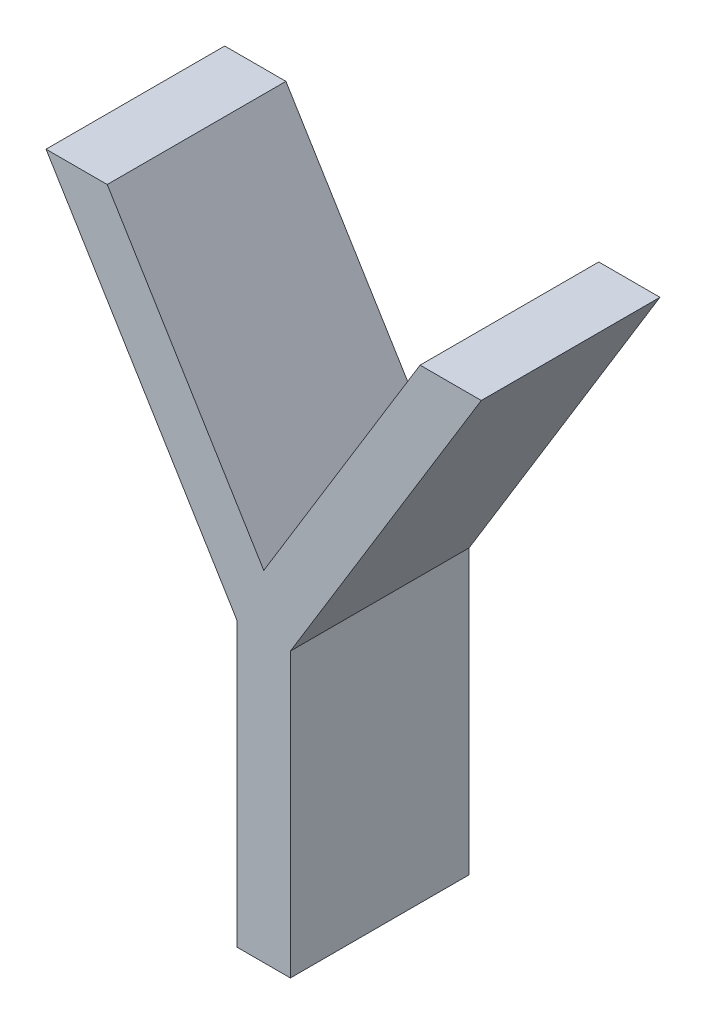
from build123d import *

# Parameters (mm, degrees)
BOSS_EXTRU_1_DEPTH = 1.5


with BuildPart() as part:
    # Esquisse1 → Boss.-Extru.1 (new body)
    with BuildSketch(Plane.XY):
        Polygon((-55.82101679, -17.854008721), (-55.307194675, -17.854008721), (-53.993092111, -20.002446221), (-52.680992752, -17.854008721), (-52.167170636, -17.854008721), (-53.769734739, -20.477205836), (-53.769734739, -22.854008721), (-54.218452688, -22.854008721), (-54.218452688, -20.477205836), align=None)
    extrude(amount=BOSS_EXTRU_1_DEPTH)


solid = part.part
